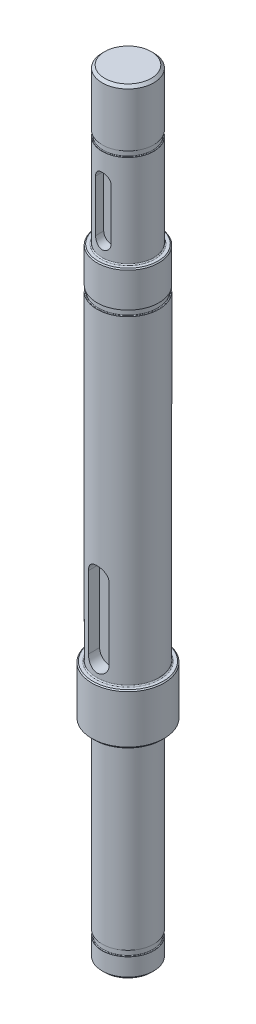
from build123d import *

# Parameters (mm, degrees)
CHAMFER1_SIZE      = 0.5
CHAMFER2_SIZE      = 0.2
FILLET1_R          = 0.2
CUT_EXTRUDE1_DEPTH = 151.529897363
CUT_EXTRUDE2_DEPTH = 1.8


with BuildPart() as part:
    # Sketch2 → Revolve1 (revolve)
    with BuildSketch(Plane(origin=(0, 0, 0), x_dir=(0, 0, -1), z_dir=(1, 0, 0)), mode=Mode.PRIVATE) as revolve1_sk:
        Polygon((0, 0), (5, 0), (5, 40), (7, 40), (7, 50), (6, 50), (6, 120), (5, 120), (5, 150), (0, 150), align=None)
    revolve(revolve1_sk.sketch.rotate(Axis((0, 150, 0), (0, -1, 0)), 180), axis=Axis((0, 150, 0), (0, -1, 0)))

    # Sketch4 → Groove for BS 3673 P4 - S010M_ External (revolve, cut)
    with BuildSketch(Plane(origin=(0, 120, 0), x_dir=(0, 0, 1), z_dir=(-1, 0, 0))):
        with BuildLine():
            Line((4.91, -116.1), (6, -116.1))
            Line((6, -116.1), (6, -115))
            Line((6, -115), (4.91, -115))
            ThreePointArc((4.91, -115), (4.832218254, -115.032218254), (4.8, -115.11))
            Line((4.8, -115.11), (4.8, -115.99))
            ThreePointArc((4.8, -115.99), (4.832218254, -116.067781746), (4.91, -116.1))
        make_face()
    revolve(axis=Axis((0, 70, 0), (0, 1, 0)), mode=Mode.SUBTRACT)

    # Sketch6 → Groove for BS 3673 P4 - S010M_ Exter 2 (revolve, cut)
    with BuildSketch(Plane(origin=(0, 120, 0), x_dir=(0, 0, 1), z_dir=(-1, 0, 0))):
        with BuildLine():
            Line((4.91, 18), (6, 18))
            Line((6, 18), (6, 19.1))
            Line((6, 19.1), (4.91, 19.1))
            ThreePointArc((4.91, 19.1), (4.832218254, 19.067781746), (4.8, 18.99))
            Line((4.8, 18.99), (4.8, 18.11))
            ThreePointArc((4.8, 18.11), (4.832218254, 18.032218254), (4.91, 18))
        make_face()
    revolve(axis=Axis((0, 70, 0), (0, 1, 0)), mode=Mode.SUBTRACT)

    # Sketch8 → Groove for BS 3673 P4 - S012M, External Circlip1 (revolve, cut)
    with BuildSketch(Plane(origin=(0, 118, 0), x_dir=(0, 0, 1), z_dir=(-1, 0, 0))):
        with BuildLine():
            Line((5.86, -6), (7.2, -6))
            Line((7.2, -6), (7.2, -4.9))
            Line((7.2, -4.9), (5.86, -4.9))
            ThreePointArc((5.86, -4.9), (5.782218254, -4.932218254), (5.75, -5.01))
            Line((5.75, -5.01), (5.75, -5.89))
            ThreePointArc((5.75, -5.89), (5.782218254, -5.967781746), (5.86, -6))
        make_face()
    revolve(axis=Axis((0, 68, 0), (0, 1, 0)), mode=Mode.SUBTRACT)

    # Chamfer1
    chamfer1_edges = [part.edges().sort_by_distance(p)[0] for p in [
        (0, 40, -7),
        (0, 0, -5),
        (0, 150, -5),
    ]]
    chamfer(chamfer1_edges, length=CHAMFER1_SIZE)

    # Chamfer2
    chamfer2_edges = [part.edges().sort_by_distance(p)[0] for p in [
        (0, 50, -7),
        (0, 120, -6),
    ]]
    chamfer(chamfer2_edges, length=CHAMFER2_SIZE)

    # Fillet1
    fillet1_edges = [part.edges().sort_by_distance(p)[0] for p in [
        (0, 40, -5),
        (0, 120, -5),
        (0, 50, -6),
    ]]
    fillet(fillet1_edges, radius=FILLET1_R)

    # Sketch9 → Cut-Extrude1 (cut, through all)
    with BuildSketch(Plane.XY.offset(3.5)):
        with BuildLine():
            Line((-2, 53), (-2, 67))
            ThreePointArc((-2, 67), (0, 69), (2, 67))
            Line((2, 67), (2, 53))
            ThreePointArc((2, 53), (0, 51), (-2, 53))
        make_face()
    extrude(amount=CUT_EXTRUDE1_DEPTH, mode=Mode.SUBTRACT)

    # Sketch10 → Cut-Extrude2 (cut)
    with BuildSketch(Plane.XY.offset(5)):
        with BuildLine():
            Line((-1.5, 123), (-1.5, 133))
            ThreePointArc((-1.5, 133), (0, 134.5), (1.5, 133))
            Line((1.5, 133), (1.5, 123))
            ThreePointArc((1.5, 123), (0, 121.5), (-1.5, 123))
        make_face()
    extrude(amount=-CUT_EXTRUDE2_DEPTH, mode=Mode.SUBTRACT)


solid = part.part
